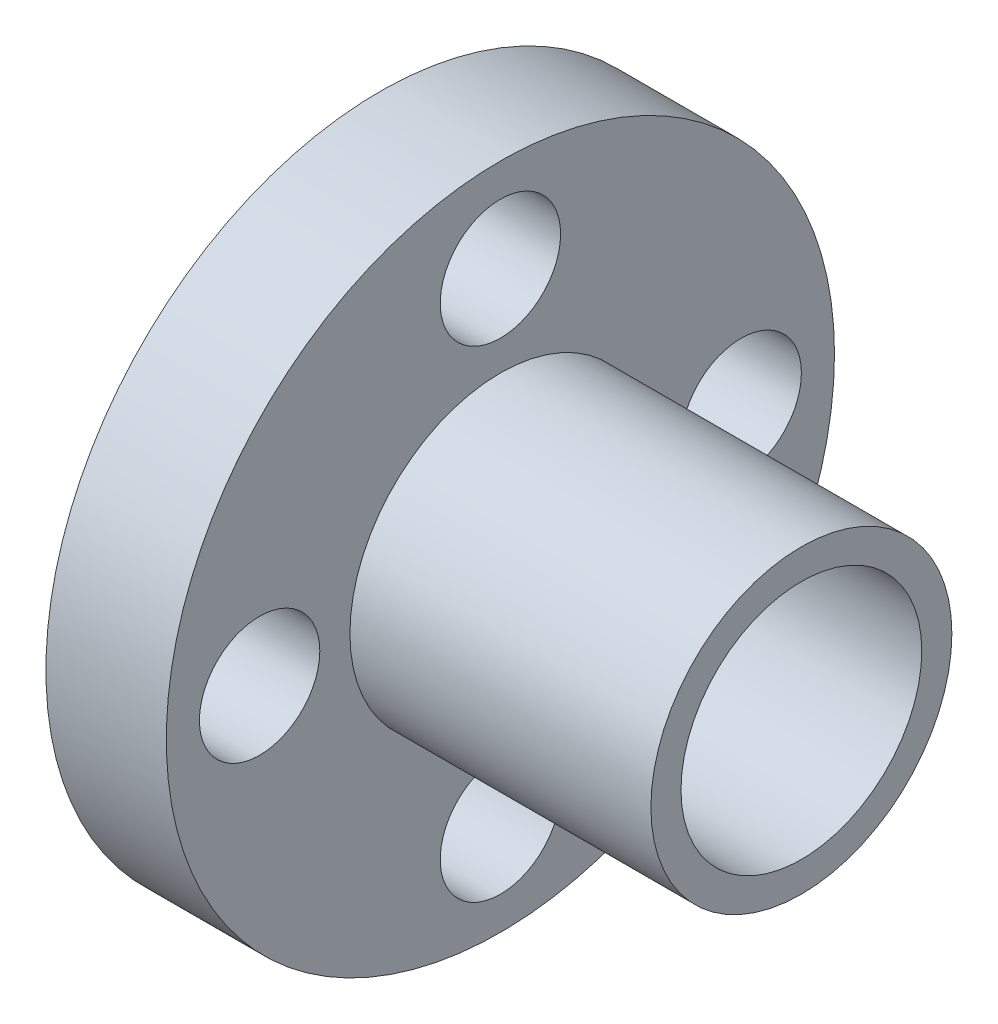
from build123d import *

# Parameters (mm, degrees)
SKETCH1_R               = 11.1
BOSS_EXTRUDE1_DEPTH     = 4
SKETCH2_R               = 5
BOSS_EXTRUDE2_DEPTH     = 10
BOSS_EXTRUDE3_START     = 1.5
SKETCH3_R               = 5
BOSS_EXTRUDE3_DEPTH     = 1.5
CUT_EXTRUDE1_DEPTH      = 23.06059836
CUT_EXTRUDE1_DEPTH_BACK = 23.06059836
SKETCH4_R               = 4
CUT_EXTRUDE2_DEPTH      = 19.612361484
CUT_EXTRUDE2_DEPTH_BACK = 19.612361484
SKETCH5_R               = 2


with BuildPart() as part:
    # Sketch1 → Boss-Extrude1 (new body)
    with BuildSketch(Plane(origin=(0, 0, 0), x_dir=(0, 0, -1), z_dir=(1, 0, 0))):
        Circle(SKETCH1_R)
    extrude(amount=BOSS_EXTRUDE1_DEPTH)

    # Sketch2 → Boss-Extrude2 (add)
    with BuildSketch(Plane(origin=(4, 0, 0), x_dir=(0, 0, -1), z_dir=(1, 0, 0))):
        Circle(SKETCH2_R)
    extrude(amount=BOSS_EXTRUDE2_DEPTH)

    # Sketch3 → Boss-Extrude3 (add)
    with BuildSketch(Plane.ZY.offset(BOSS_EXTRUDE3_START)):
        with Locations(Location((0, 0, 0), (0, 0, 180))):
            Circle(SKETCH3_R)
    extrude(amount=-BOSS_EXTRUDE3_DEPTH)

    # Sketch4 → Cut-Extrude1 (cut, two sides: drawn at the far end of the back side and taken through both)
    with BuildSketch(Plane.ZY.offset(1.5).offset(-CUT_EXTRUDE1_DEPTH_BACK)):
        Circle(SKETCH4_R)
    extrude(amount=CUT_EXTRUDE1_DEPTH + CUT_EXTRUDE1_DEPTH_BACK, mode=Mode.SUBTRACT)

    # Sketch5 → Cut-Extrude2 (cut, two sides: drawn at the far end of the back side and taken through both)
    with BuildSketch(Plane(origin=(4, 0, 0), x_dir=(0, 0, -1), z_dir=(1, 0, 0)).offset(-CUT_EXTRUDE2_DEPTH_BACK)):
        with Locations((0, 8)):
            Circle(SKETCH5_R)
        with Locations((8, 0)):
            Circle(SKETCH5_R)
        with Locations((0, -8)):
            Circle(SKETCH5_R)
        with Locations((-8, 0)):
            Circle(SKETCH5_R)
    extrude(amount=CUT_EXTRUDE2_DEPTH + CUT_EXTRUDE2_DEPTH_BACK, mode=Mode.SUBTRACT)


solid = part.part
